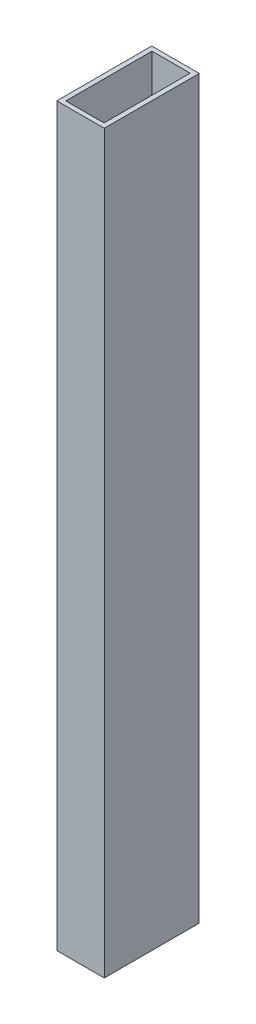
from build123d import *

# Parameters (mm, degrees)
SKETCH1_W               = 25.4
SKETCH1_H               = 50.8
BOSS_EXTRUDE1_DEPTH     = 393.7
CUT_EXTRUDE1_DEPTH      = 10
CUT_EXTRUDE1_DEPTH_BACK = 393.7
SKETCH5_W               = 20.420863107
SKETCH5_H               = 46.117633818


with BuildPart() as part:
    # Sketch1 → Boss-Extrude1 (new body)
    with BuildSketch(Plane(origin=(0, 0, 0), x_dir=(1, 0, 0), z_dir=(0, 1, 0))):
        with Locations((2.728536082, 0.295993891)):
            Rectangle(SKETCH1_W, SKETCH1_H)
    extrude(amount=BOSS_EXTRUDE1_DEPTH)

    # Sketch5 → Cut-Extrude1 (cut, two sides: drawn at the far end of the back side and taken through both)
    with BuildSketch(Plane(origin=(0, 393.7, 0), x_dir=(1, 0, 0), z_dir=(0, 1, 0)).offset(-CUT_EXTRUDE1_DEPTH_BACK)):
        with Locations((2.697501427, 0.327028619)):
            Rectangle(SKETCH5_W, SKETCH5_H)
    extrude(amount=CUT_EXTRUDE1_DEPTH + CUT_EXTRUDE1_DEPTH_BACK, mode=Mode.SUBTRACT)


solid = part.part
